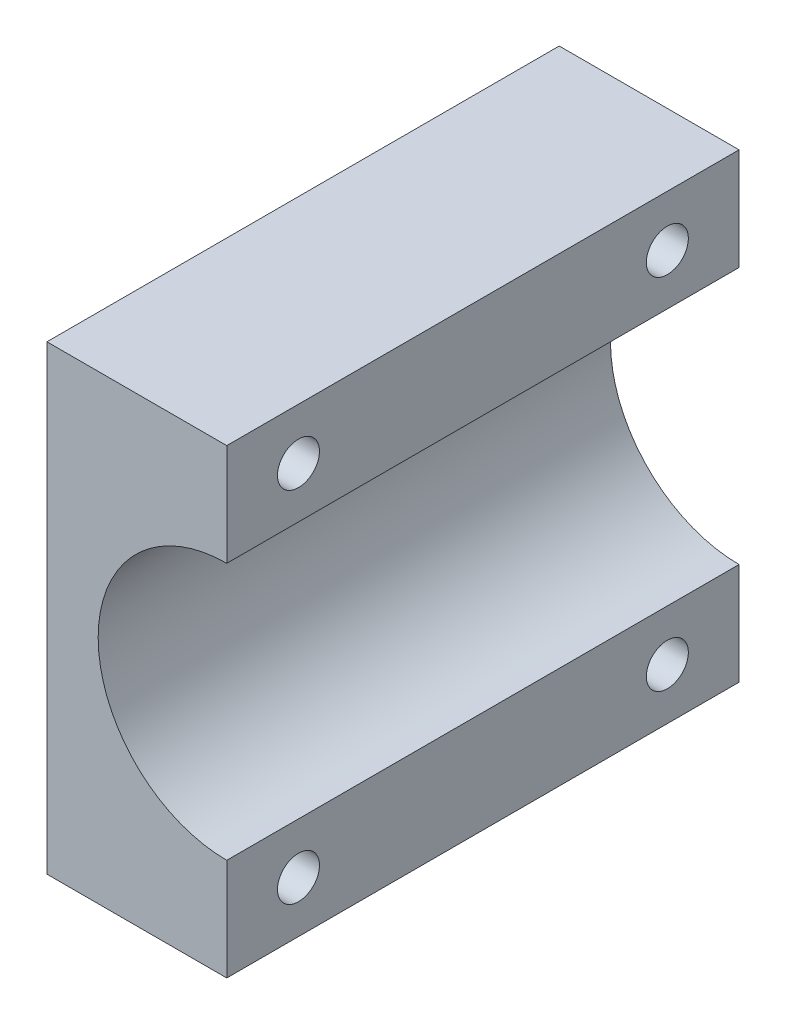
from build123d import *
from build123d.topology import SkipClean

# Parameters (mm, degrees)
BOSS_EXTRUDE1_DEPTH             = 25
BOSS_EXTRUDE2_REACH             = 65.436
BOSS_EXTRUDE2_DIRECTION_2_DEPTH = 30
SKETCH9_R                       = 2.05
CUT_EXTRUDE3_DEPTH              = 35.1
BOSS_EXTRUDE5_REACH             = 63.632
SKETCH13_R                      = 1.55
CUT_EXTRUDE4_DEPTH              = 88.768186926
SKETCH16_W                      = 63
SKETCH16_H                      = 45
CUT_EXTRUDE5_DEPTH              = 65.271143


with BuildPart() as part:
    # Sketch1 → Boss-Extrude1 (new, symmetric)
    with BuildSketch(Plane.XY):
        with BuildLine():
            Line((-17.55, 22.5), (-17.55, 0))
            Line((-17.55, 0), (17.55, 0))
            Line((17.55, 0), (17.55, 22.5))
            Line((17.55, 22.5), (12.55, 22.5))
            ThreePointArc((12.55, 22.5), (0, 9.95), (-12.55, 22.5))
            Line((-12.55, 22.5), (-17.55, 22.5))
        make_face()
    boss_extrude1 = extrude(amount=BOSS_EXTRUDE1_DEPTH, both=True)

    # Boss-Extrude2: up to this face of the body (flat: up to its plane)
    boss_extrude2_end = Plane(part.part.faces().sort_by_distance((17.55, 11.25, 0))[0])
    # Sketch5 → Boss-Extrude2 (add, up to the picked face)
    with BuildSketch(Plane(origin=(26.152881057, 0, 15.099372918), x_dir=(0.500000000000001, 0, -0.8660254037844382), z_dir=(0.8660254037844382, 0, 0.500000000000001)), mode=Mode.PRIVATE) as boss_extrude2_sk1:
        with BuildLine():
            Line((-8.725, 22.5), (-3.775, 22.5))
            ThreePointArc((-3.775, 22.5), (8.775, 9.95), (21.325, 22.5))
            Line((21.325, 22.5), (26.275, 22.5))
            ThreePointArc((26.275, 22.5), (8.775, 5), (-8.725, 22.5))
        make_face()
    boss_extrude2_tool1 = split(extrude(boss_extrude2_sk1.sketch, amount=-BOSS_EXTRUDE2_REACH, mode=Mode.PRIVATE), bisect_by=boss_extrude2_end, keep=Keep.BOTH, mode=Mode.PRIVATE)
    boss_extrude2 = boss_extrude2_tool1.solids().sort_by(Axis((23.027881, 22.108688, 20.512032), (-0.8660254037844382, 0, -0.500000000000001)))[0]
    add(boss_extrude2)

    # Sketch5 → Boss-Extrude2 direction 2 (add)
    with BuildSketch(Plane(origin=(26.152881057, 0, 15.099372918), x_dir=(0.500000000000001, 0, -0.8660254037844382), z_dir=(0.8660254037844382, 0, 0.500000000000001))):
        with BuildLine():
            Line((-8.725, 22.5), (-3.775, 22.5))
            ThreePointArc((-3.775, 22.5), (8.775, 9.95), (21.325, 22.5))
            Line((21.325, 22.5), (26.275, 22.5))
            ThreePointArc((26.275, 22.5), (8.775, 5), (-8.725, 22.5))
        make_face()
    boss_extrude2_direction_2 = extrude(amount=BOSS_EXTRUDE2_DIRECTION_2_DEPTH)

    # Sketch9 → Cut-Extrude3 (cut)
    with BuildSketch(Plane.ZY.offset(17.55)):
        with Locations((-18, 5)):
            Circle(SKETCH9_R)
        with Locations((18, 5)):
            Circle(SKETCH9_R)
    cut_extrude3 = extrude(amount=-CUT_EXTRUDE3_DEPTH, mode=Mode.SUBTRACT)

    # Boss-Extrude5: up to this face of the body (flat: up to its plane)
    boss_extrude5_end = Plane(part.part.faces().sort_by_distance((17.55, 17.173614571, 0))[0])
    # Sketch12 → Boss-Extrude5 (add, up to the picked face)
    with BuildSketch(Plane(origin=(22.035576211, 0, 12.722245857), x_dir=(0.4999999999999999, 0, -0.8660254037844388), z_dir=(0.8660254037844388, 0, 0.4999999999999999)), mode=Mode.PRIVATE) as boss_extrude5_sk1:
        with BuildLine():
            Line((-3.775, 22.5), (21.325, 22.5))
            ThreePointArc((21.325, 22.5), (8.775, 9.95), (-3.775, 22.5))
        make_face()
    boss_extrude5_tool1 = split(extrude(boss_extrude5_sk1.sketch, amount=-BOSS_EXTRUDE5_REACH, mode=Mode.PRIVATE), bisect_by=boss_extrude5_end, keep=Keep.BOTH, mode=Mode.PRIVATE)
    boss_extrude5 = boss_extrude5_tool1.solids().sort_by(Axis((26.423076, 17.173615, 5.122873), (-0.8660254037844388, 0, -0.4999999999999999)))[0]
    add(boss_extrude5)


with BuildPart() as mirror1_1:
    # Mirror1: Boss-Extrude1, Boss-Extrude2, Boss-Extrude2 direction 2 across plane
    add(boss_extrude1.mirror(Plane(origin=(17.55, 22.5, 25), x_dir=(0, 0, 1), z_dir=(0, -1, 0))))
    add(boss_extrude2.mirror(Plane(origin=(17.55, 22.5, 25), x_dir=(0, 0, 1), z_dir=(0, -1, 0))))
    add(boss_extrude2_direction_2.mirror(Plane(origin=(17.55, 22.5, 25), x_dir=(0, 0, 1), z_dir=(0, -1, 0))))

    # Mirror1 2: Cut-Extrude3 across plane
    add(cut_extrude3.mirror(Plane(origin=(17.55, 22.5, 25), x_dir=(0, 0, 1), z_dir=(0, -1, 0))), mode=Mode.SUBTRACT)


with BuildPart() as mirror1_3_1:
    # Mirror1 3: Boss-Extrude5 across plane
    add(boss_extrude5.mirror(Plane(origin=(17.55, 22.5, 25), x_dir=(0, 0, 1), z_dir=(0, -1, 0))))


with BuildPart() as part_1:
    add(part.part)

    # Mirror1 united with what the copies touc: union Mirror1_1, Mirror1 3_1
    add(mirror1_1.part)
    add(mirror1_3_1.part)

    # Sketch13 → Cut-Extrude4 (cut, through all)
    with SkipClean():  # the faces are left unmerged after this step: merging them gives an invalid solid
        with BuildSketch(Plane(origin=(0, 0, 0), x_dir=(1, 0, 0), z_dir=(0, 1, 0))):
            with Locations(Location((43.530762114, -15, 0), (0, 0, 90))):
                Circle(SKETCH13_R)
        extrude(amount=CUT_EXTRUDE4_DEPTH, mode=Mode.SUBTRACT)

    # Sketch16 → Cut-Extrude5 (cut)
    with BuildSketch(Plane(origin=(0, 0, 0), x_dir=(0, 0, -1), z_dir=(1, 0, 0))):
        with Locations((-6.5, 22.5)):
            Rectangle(SKETCH16_W, SKETCH16_H)
    extrude(amount=CUT_EXTRUDE5_DEPTH, mode=Mode.SUBTRACT)


solid = part_1.part
